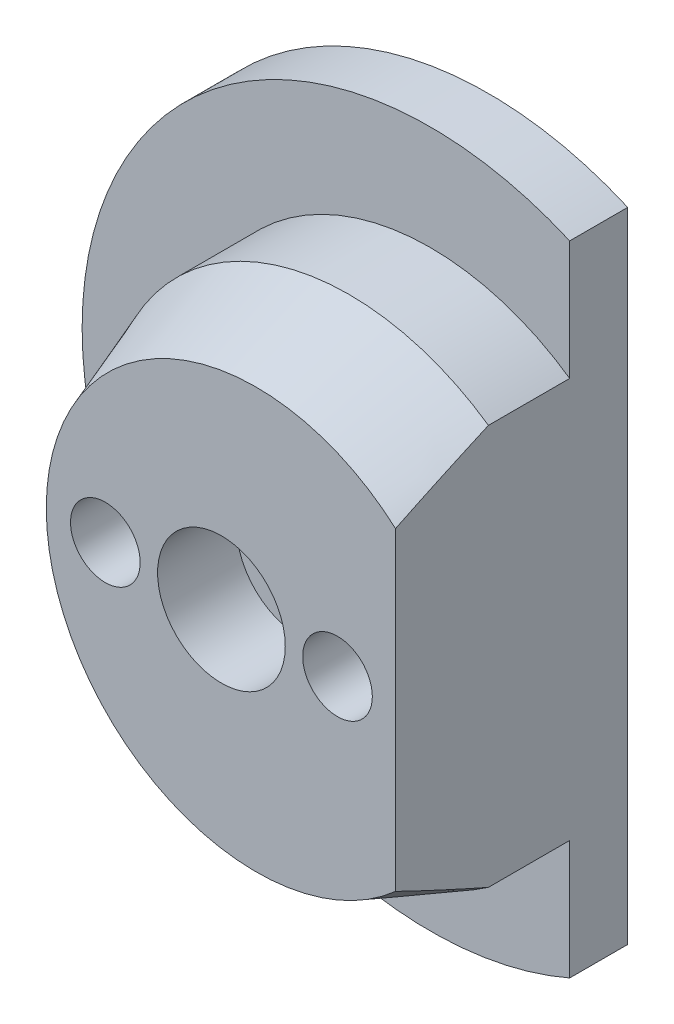
from build123d import *

# Parameters (mm, degrees)
SKETCH_1_R                = 30
EXTRUDE_1_DEPTH           = 20
MM_1_D                    = 6
MM_1_DEPTH                = 20
MM_1_TIP                  = 1.802581857
HOLE_WIZARD_1_D           = 6.6
HOLE_WIZARD_1_DEPTH       = 20
HOLE_WIZARD_1_CBORE_D     = 11
HOLE_WIZARD_1_CBORE_DEPTH = 6.8
HOLE_WIZARD_1_TIP         = 1.982840043
SKETCH_6_OUTSIDE_W        = 79.436
SKETCH_6_OUTSIDE_H        = 79.436
SKETCH_6_OUTSIDE_R        = 21
CUT_EXTRUDE_1_DEPTH       = 15
CHAMFER_1_SIZE            = 8
CHAMFER_1_SIZE2           = 2.911761874
SKETCH_7_W                = 35.972327204
SKETCH_7_H                = 68.406392716
CUT_EXTRUDE_2_DEPTH       = 47.904157598


with BuildPart() as part:
    # 草图1 → 凸台-拉伸1 (new body)
    with BuildSketch(Plane.XY):
        Circle(SKETCH_1_R)
    extrude(amount=EXTRUDE_1_DEPTH)

    # 大小mm 暗销孔1
    with Locations(Plane.XY.offset(20)):
        with Locations((-13, 0), (7, 0)):
            Hole(MM_1_D / 2, depth=MM_1_DEPTH)
            with Locations((0, 0, -(MM_1_DEPTH + MM_1_TIP / 2))):  # 118° drill point
                Cone(0, MM_1_D / 2, MM_1_TIP, mode=Mode.SUBTRACT)

    # 打孔尺寸(%根据)内六角圆柱头螺钉的类型1
    with Locations(Plane.XY.offset(20)):
        with Locations((-3, 0)):
            CounterBoreHole(HOLE_WIZARD_1_D / 2, HOLE_WIZARD_1_CBORE_D / 2, HOLE_WIZARD_1_CBORE_DEPTH, depth=HOLE_WIZARD_1_DEPTH)
            with Locations((0, 0, -(HOLE_WIZARD_1_DEPTH + HOLE_WIZARD_1_TIP / 2))):  # 118° drill point
                Cone(0, HOLE_WIZARD_1_D / 2, HOLE_WIZARD_1_TIP, mode=Mode.SUBTRACT)

    # 草图6 outside → 切除-拉伸1 (cut)
    with BuildSketch(Plane.XY.offset(20)):
        Rectangle(SKETCH_6_OUTSIDE_W, SKETCH_6_OUTSIDE_H)
        Circle(SKETCH_6_OUTSIDE_R, mode=Mode.SUBTRACT)
    extrude(amount=-CUT_EXTRUDE_1_DEPTH, mode=Mode.SUBTRACT)

    # 倒角1
    chamfer_1_edges = [part.edges().sort_by_distance(p)[0] for p in [
        (-21, 0, 20),
    ]]
    chamfer_1_side = [part.faces().sort_by_distance(p)[0] for p in [
        (-21, 0, 12.5),
    ]]
    chamfer(chamfer_1_edges, length=CHAMFER_1_SIZE, length2=CHAMFER_1_SIZE2, reference=chamfer_1_side[0])

    # 草图7 → 切除-拉伸2 (cut, through all)
    with BuildSketch(Plane.XY.offset(20)):
        with Locations((29.986163602, -1.092611915)):
            Rectangle(SKETCH_7_W, SKETCH_7_H)
    extrude(amount=-CUT_EXTRUDE_2_DEPTH, mode=Mode.SUBTRACT)


solid = part.part
